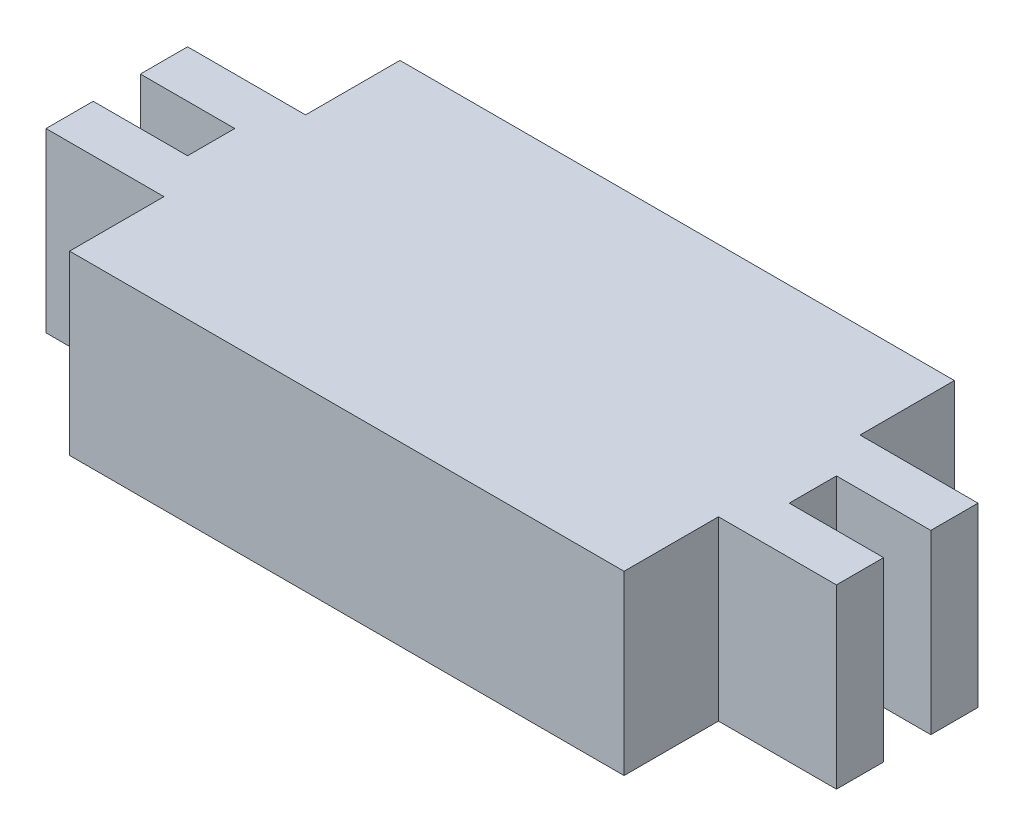
from build123d import *

# Parameters (mm, degrees)
BOSS_EXTRU_1_DEPTH = 15


with BuildPart() as part:
    # Esquisse1 → Boss.-Extru.1 (new body)
    with BuildSketch(Plane(origin=(0, 0, 0), x_dir=(1, 0, 0), z_dir=(0, 1, 0))):
        Polygon((23.5, 6), (23.5, 14), (-23.5, 14), (-23.5, 6), (-33.5, 6), (-33.5, 2), (-25.5, 2), (-25.5, -2), (-33.5, -2), (-33.5, -6), (-23.5, -6), (-23.5, -14), (23.5, -14), (23.5, -6), (33.5, -6), (33.5, -2), (25.5, -2), (25.5, 2), (33.5, 2), (33.5, 6), align=None)
    extrude(amount=BOSS_EXTRU_1_DEPTH)


solid = part.part
